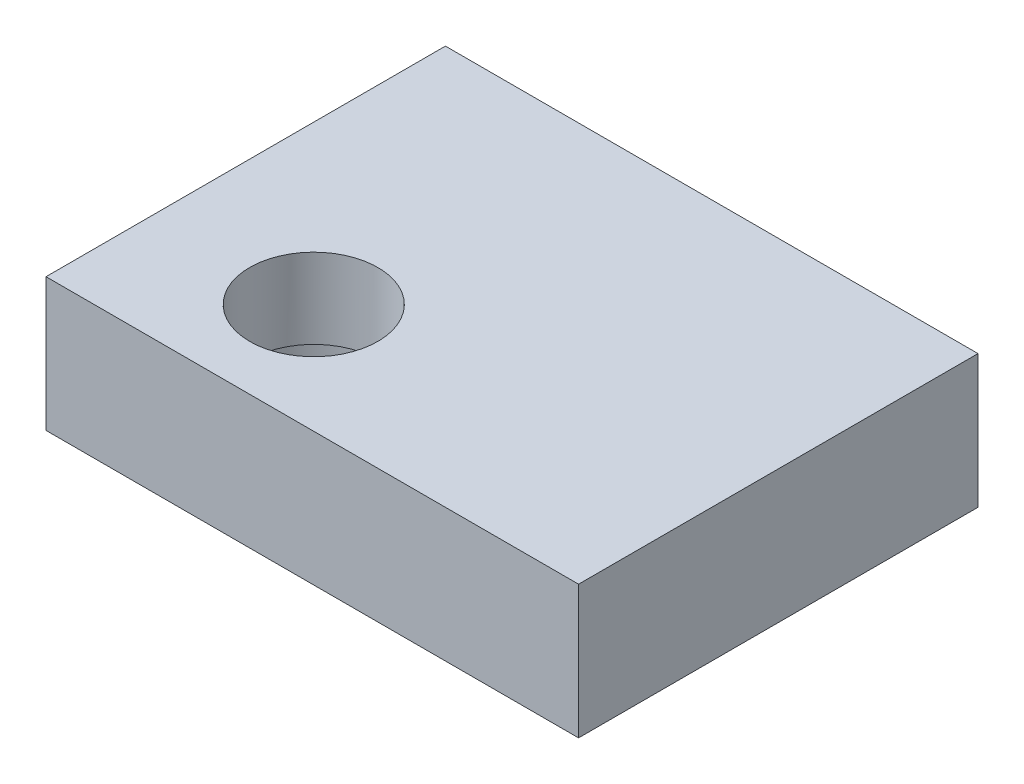
from build123d import *

# Parameters (mm, degrees)
SKETCH1_W           = 40
SKETCH1_H           = 30
BOSS_EXTRUDE1_DEPTH = 10
SKETCH2_R           = 1.55
SKETCH2_R_2         = 6.3
CUT_EXTRUDE1_DEPTH  = 4
SKETCH3_R           = 4.8125
CUT_EXTRUDE2_DEPTH  = 10


with BuildPart() as part:
    # Sketch1 → Boss-Extrude1 (new body)
    with BuildSketch(Plane(origin=(0, 0, 0), x_dir=(1, 0, 0), z_dir=(0, 1, 0))):
        Rectangle(SKETCH1_W, SKETCH1_H)
    extrude(amount=BOSS_EXTRUDE1_DEPTH)

    # Sketch2 → Cut-Extrude1 (cut)
    with BuildSketch(Plane(origin=(0, 0, 0), x_dir=(-1, 0, 0), z_dir=(0, -1, 0))):
        with Locations(Location((-13.333333333, -10, 0), (0, 0, 90))):
            Circle(SKETCH2_R)
        with Locations(Location((-13.333333333, 10, 0), (0, 0, 270))):
            Circle(SKETCH2_R)
        with Locations(Location((13.333333333, 10, 0), (0, 0, 90))):
            Circle(SKETCH2_R)
        with Locations(Location((8.14, -6.75, 0), (0, 0, 90))):
            Circle(SKETCH2_R_2)
    extrude(amount=-CUT_EXTRUDE1_DEPTH, mode=Mode.SUBTRACT)

    # Sketch3 → Cut-Extrude2 (cut)
    with BuildSketch(Plane(origin=(0, 10, 0), x_dir=(1, 0, 0), z_dir=(0, 1, 0))):
        with Locations(Location((-8.14, -6.75, 0), (0, 0, 270))):
            Circle(SKETCH3_R)
    extrude(amount=-CUT_EXTRUDE2_DEPTH, mode=Mode.SUBTRACT)


solid = part.part
